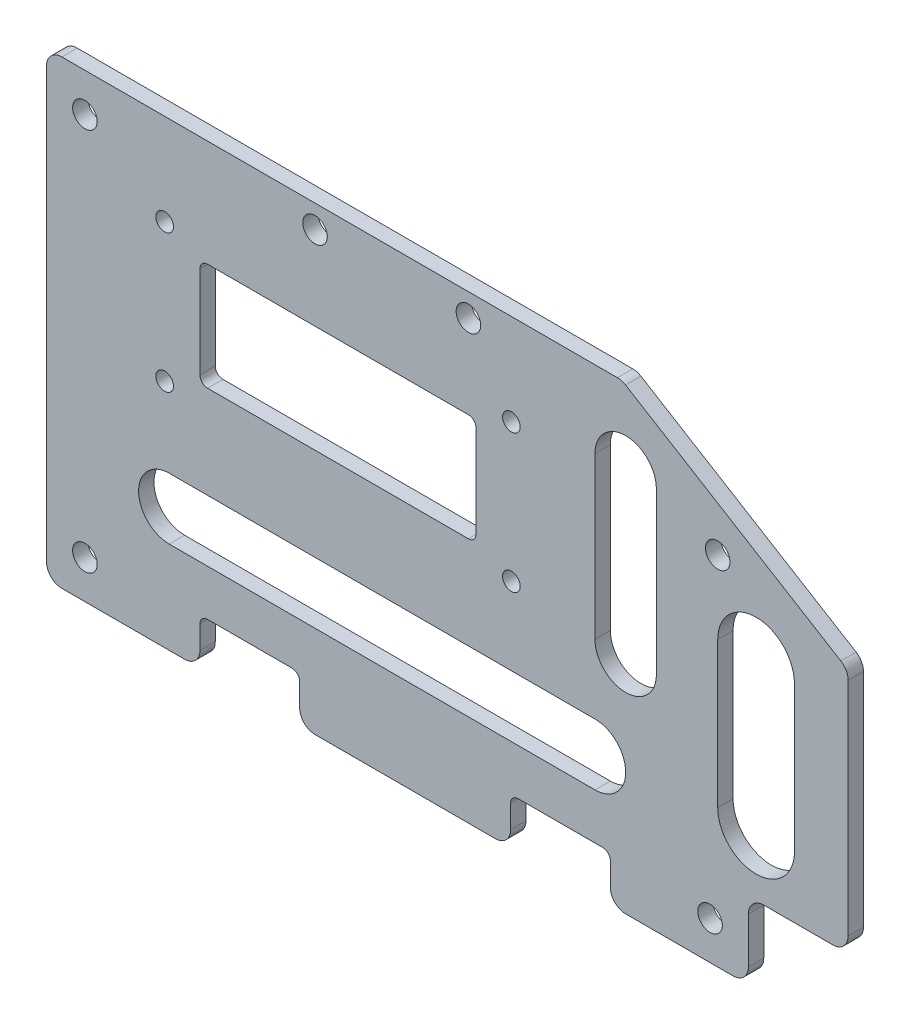
from build123d import *

# Parameters (mm, degrees)
SKETCH_1_R          = 1.6
SKETCH_1_R_2        = 1.15
SKETCH_1_W          = 36
SKETCH_1_H          = 14
EXTRUDE_1_DEPTH     = 2
CUT_EXTRUDE_1_DEPTH = 121.516596367
FILLET_1_R          = 2
FILLET_2_R          = 1
FILLET_3_R          = 1


with BuildPart() as part:
    # 草图1 → 凸台-拉伸1 (new body)
    with BuildSketch(Plane.XY):
        Polygon((0, 0), (0, 60), (75, 60), (104.5, 42), (104.5, 10), (91.5, 10), (91.5, 0), (73.5, 0), (73.5, 6), (60.5, 6), (60.5, 0), (33, 0), (33, 6), (20, 6), (20, 0), align=None)
        with Locations((86.5, 5)):
            Circle(SKETCH_1_R, mode=Mode.SUBTRACT)
        with Locations((5, 5)):
            Circle(SKETCH_1_R, mode=Mode.SUBTRACT)
        with Locations((60.6, 48.1)):
            Circle(SKETCH_1_R_2, mode=Mode.SUBTRACT)
        with Locations((60.6, 30.1)):
            Circle(SKETCH_1_R_2, mode=Mode.SUBTRACT)
        with Locations((15.4, 48.1)):
            Circle(SKETCH_1_R_2, mode=Mode.SUBTRACT)
        with Locations((15.4, 30.1)):
            Circle(SKETCH_1_R_2, mode=Mode.SUBTRACT)
        with Locations((87.5, 46.515606374)):
            Circle(SKETCH_1_R, mode=Mode.SUBTRACT)
        with Locations((55, 57)):
            Circle(SKETCH_1_R, mode=Mode.SUBTRACT)
        with Locations((35, 57)):
            Circle(SKETCH_1_R, mode=Mode.SUBTRACT)
        with Locations((5, 55)):
            Circle(SKETCH_1_R, mode=Mode.SUBTRACT)
        with BuildLine():
            Line((71.5, 12), (16, 12))
            ThreePointArc((16, 12), (12, 16), (16, 20))
            Line((16, 20), (71.5, 20))
            ThreePointArc((71.5, 20), (75.5, 16), (71.5, 12))
        make_face(mode=Mode.SUBTRACT)
        with Locations((38, 39.1)):
            Rectangle(SKETCH_1_W, SKETCH_1_H, mode=Mode.SUBTRACT)
    extrude(amount=EXTRUDE_1_DEPTH)

    # 草图2 → 切除-拉伸1 (cut, through all)
    with BuildSketch(Plane(origin=(0, 0, 0), x_dir=(-1, 0, 0), z_dir=(0, 0, -1))):
        with BuildLine():
            Line((-87.5, 37), (-87.5, 18))
            ThreePointArc((-87.5, 18), (-92.5, 13), (-97.5, 18))
            Line((-97.5, 18), (-97.5, 37))
            ThreePointArc((-97.5, 37), (-92.5, 42), (-87.5, 37))
        make_face()
        with BuildLine():
            Line((-71.5, 50), (-71.5, 29))
            ThreePointArc((-71.5, 29), (-75.5, 25), (-79.5, 29))
            Line((-79.5, 29), (-79.5, 50))
            ThreePointArc((-79.5, 50), (-75.5, 54), (-71.5, 50))
        make_face()
    extrude(amount=-CUT_EXTRUDE_1_DEPTH, mode=Mode.SUBTRACT)

    # 圆角1
    fillet_1_edges = [part.edges().sort_by_distance(p)[0] for p in [
        (0, 0, 1),
        (0, 60, 1),
        (75, 60, 1),
        (104.5, 42, 1),
        (104.5, 10, 1),
        (91.5, 10, 1),
        (91.5, 0, 1),
        (73.5, 0, 1),
        (60.5, 0, 1),
        (33, 0, 1),
        (20, 0, 1),
    ]]
    fillet(fillet_1_edges, radius=FILLET_1_R)

    # 圆角2
    fillet_2_edges = [part.edges().sort_by_distance(p)[0] for p in [
        (56, 32.1, 1),
        (56, 46.1, 1),
        (20, 46.1, 1),
        (20, 32.1, 1),
    ]]
    fillet(fillet_2_edges, radius=FILLET_2_R)

    # 圆角3
    fillet_3_edges = [part.edges().sort_by_distance(p)[0] for p in [
        (73.5, 6, 1),
        (60.5, 6, 1),
        (33, 6, 1),
        (20, 6, 1),
    ]]
    fillet(fillet_3_edges, radius=FILLET_3_R)


solid = part.part
